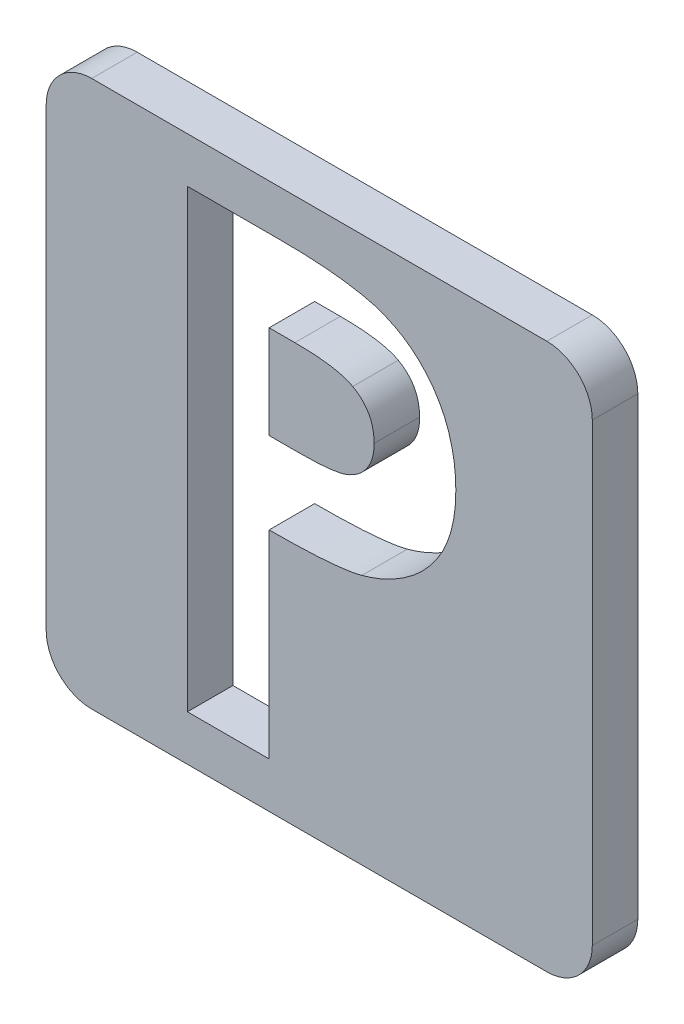
from build123d import *

# Parameters (mm, degrees)
BOSS_EXTRUDE1_DEPTH = 10
CUT_EXTRUDE29_DEPTH = 10


with BuildPart() as part:
    # Sketch1 → Boss-Extrude1 (new body)
    with BuildSketch(Plane.XY):
        with BuildLine():
            Line((-50, 60), (50, 60))
            ThreePointArc((50, 60), (57.071067812, 57.071067812), (60, 50))
            Line((60, 50), (60, -50))
            ThreePointArc((60, -50), (57.071067812, -57.071067812), (50, -60))
            Line((50, -60), (-50, -60))
            ThreePointArc((-50, -60), (-57.071067812, -57.071067812), (-60, -50))
            Line((-60, -50), (-60, 50))
            ThreePointArc((-60, 50), (-57.071067812, 57.071067812), (-50, 60))
        make_face()
    extrude(amount=BOSS_EXTRUDE1_DEPTH)

    # Sketch2 → Cut-Extrude29 (cut)
    with BuildSketch(Plane.XY.offset(10)):
        with BuildLine():
            Line((-28.961538462, 50), (-8.929487179, 50))
            add(Edge.make_bspline(
                [(-8.929487179, 50), (-7.620618936, 49.994141227), (-5.095537738, 49.982838426), (-1.454162904, 49.845776931), (1.905183672, 49.600154382), (4.981730185, 49.296603755), (7.774211636, 48.871037587), (10.286125049, 48.383159297), (12.517991706, 47.788781545), (14.494979223, 47.083263391), (16.269261659, 46.251485051), (17.948305103, 45.365581747), (19.494162988, 44.308287399), (20.984859429, 43.193552701), (22.335168741, 41.914887476), (23.629331304, 40.557388751), (24.812535801, 39.067219241), (25.890264764, 37.462417049), (26.867930999, 35.772632056), (27.722085625, 33.994843429), (28.414928025, 32.126238002), (28.996136647, 30.178903528), (29.462969075, 28.152924877), (29.7737076, 26.035842099), (29.984776838, 23.842437471), (30.003400784, 22.349604897), (30.012820513, 21.594551282)],
                knots=[0, 0, 0, 0, 1.698747864, 3.27724071, 4.728299578, 6.070144658, 7.288476769, 8.393259625, 9.389771311, 10.283485332, 11.113357557, 11.931608583, 12.74405601, 13.541433047, 14.344816069, 15.154114104, 15.974336324, 16.810834471, 17.661136416, 18.50621059, 19.367396281, 20.244825668, 21.142564693, 22.063065223, 23.020325768, 24, 24, 24, 24], degree=3))
            add(Edge.make_bspline(
                [(30.012820513, 21.594551282), (29.999191345, 20.759253445), (29.972408355, 19.117790551), (29.709848746, 16.711607332), (29.261313979, 14.417529485), (28.6751025, 12.216210642), (27.857672281, 10.143867376), (26.923796642, 8.151052942), (25.77483339, 6.293639738), (24.461959194, 4.548393764), (23.028150794, 2.901125345), (21.439369639, 1.399396242), (19.725898582, 0.03296922), (17.897656293, -1.212475984), (15.947779001, -2.334427029), (13.877673639, -3.343389794), (11.673204355, -4.207094523), (10.13807827, -4.658805102), (9.359775641, -4.887820513)],
                knots=[0, 0, 0, 0, 1.102006807, 2.165578795, 3.188629044, 4.184801286, 5.166646146, 6.124351954, 7.085497154, 8.042432466, 9.003981491, 9.963833307, 10.922997304, 11.89326795, 12.880200226, 13.889073926, 14.929769137, 16, 16, 16, 16], degree=3))
            add(Edge.make_bspline(
                [(9.359775641, -4.887820513), (8.847140758, -5.015364901), (7.736608523, -5.291667119), (5.898982698, -5.572183219), (3.781311876, -5.830100526), (1.376748242, -6.051749227), (-1.316094491, -6.202418697), (-4.294608949, -6.320084852), (-7.560144946, -6.405640299), (-9.830869546, -6.408676181), (-11.012820513, -6.41025641)],
                knots=[0, 0, 0, 0, 0.618981996, 1.340914327, 2.176866532, 3.120127938, 4.170906482, 5.338178032, 6.614476169, 8, 8, 8, 8], degree=3))
            Line((-11.012820513, -6.41025641), (-11.012820513, -50))
            Line((-11.012820513, -50), (-28.961538462, -50))
            Line((-28.961538462, -50), (-28.961538462, 50))
        make_face()
        with BuildLine():
            Line((-11.012820513, 11.538461538), (-4.662660256, 11.538461538))
            add(Edge.make_bspline(
                [(-4.662660256, 11.538461538), (-3.507148343, 11.545788381), (-1.380989256, 11.55926988), (1.522593241, 11.75422019), (3.855967987, 12.051948691), (5.699377367, 12.478960217), (7.154923674, 13.127006749), (8.410241237, 13.876674553), (9.486959158, 14.824608912), (10.419238402, 15.907786113), (11.16456756, 17.152411006), (11.681414511, 18.538217292), (12.017148129, 20.036087696), (12.048156247, 21.078506356), (12.064102564, 21.614583333)],
                knots=[0, 0, 0, 0, 1.8619151, 3.425951444, 4.686033666, 5.651700536, 6.461346321, 7.243864085, 7.999046032, 8.762387399, 9.539336099, 10.322741239, 11.137448474, 12, 12, 12, 12], degree=3))
            add(Edge.make_bspline(
                [(12.064102564, 21.614583333), (12.048320277, 22.082946807), (12.017698846, 22.991684556), (11.792745473, 24.30321853), (11.434234506, 25.525838751), (10.914765898, 26.646776569), (10.243215991, 27.664127333), (9.424460756, 28.577490271), (8.469006429, 29.406425825), (7.731339827, 29.845194075), (7.356570513, 30.068108974)],
                knots=[0, 0, 0, 0, 1.102301479, 2.1387299, 3.123554645, 4.094223062, 5.036071848, 5.982632524, 6.975082478, 8, 8, 8, 8], degree=3))
            add(Edge.make_bspline(
                [(7.356570513, 30.068108974), (7.03911927, 30.228653171), (6.367009937, 30.568558133), (5.222342581, 30.963722505), (3.901413931, 31.297087184), (2.39530623, 31.573776649), (0.710027777, 31.788516408), (-1.154120751, 31.952738604), (-3.19988262, 32.018778746), (-4.622587592, 32.040148784), (-5.363782051, 32.051282051)],
                knots=[0, 0, 0, 0, 0.656809284, 1.390599849, 2.23162475, 3.173112763, 4.218524733, 5.370385145, 6.63003504, 8, 8, 8, 8], degree=3))
            Line((-5.363782051, 32.051282051), (-11.012820513, 32.051282051))
            Line((-11.012820513, 32.051282051), (-11.012820513, 11.538461538))
        make_face(mode=Mode.SUBTRACT)
    extrude(amount=-CUT_EXTRUDE29_DEPTH, mode=Mode.SUBTRACT)


with BuildPart() as cut_extrude29_piece_1:
    # of the separate pieces the step leaves, piece 1, a body of its own (cut_extrude29_pieces)
    add(part.part.solids().sort_by_distance((-50, 60, 0))[0])


with BuildPart() as cut_extrude29_piece_2:
    # of the separate pieces the step leaves, piece 2, a body of its own (cut_extrude29_pieces)
    add(part.part.solids().sort_by_distance((-11.012820513, 11.538461538, 0))[0])


solid = Compound([cut_extrude29_piece_1.part, cut_extrude29_piece_2.part])
